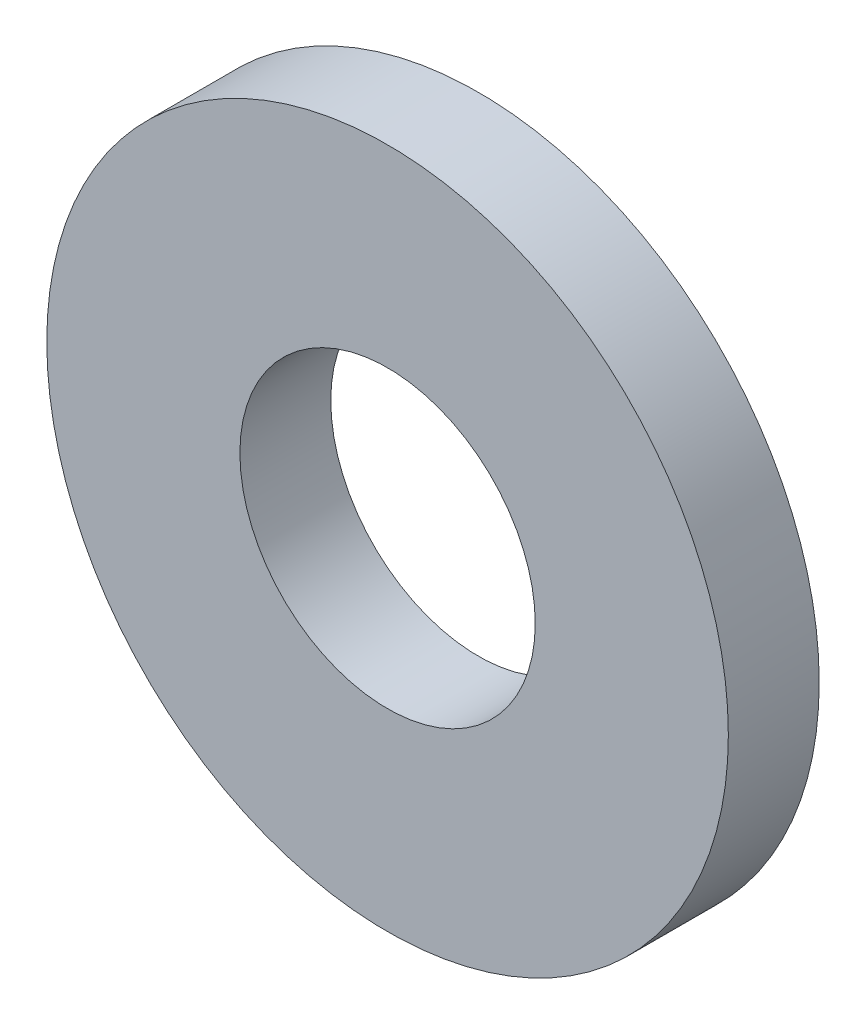
from build123d import *

# Parameters (mm, degrees)
CROQUIS1_R              = 7.5
CROQUIS1_R_2            = 3.25
SALIENTE_EXTRUIR1_DEPTH = 2


with BuildPart() as part:
    # Croquis1 → Saliente-Extruir1 (new body)
    with BuildSketch(Plane.XY):
        Circle(CROQUIS1_R)
        Circle(CROQUIS1_R_2, mode=Mode.SUBTRACT)
    extrude(amount=SALIENTE_EXTRUIR1_DEPTH)


solid = part.part
